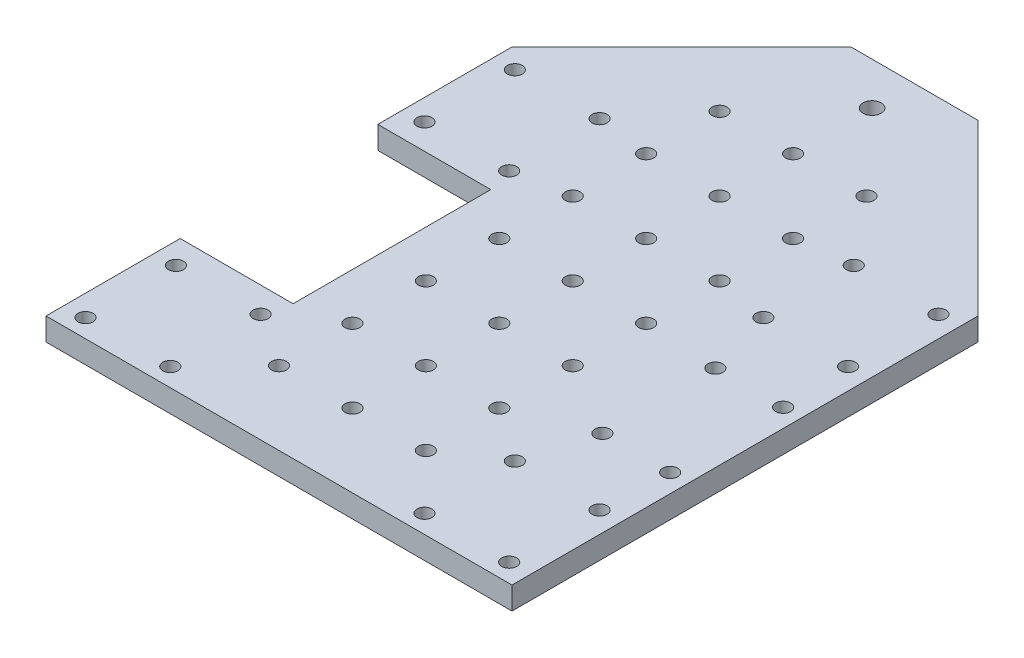
from build123d import *

# Parameters (mm, degrees)
SKETCH1_W                = 165
SKETCH1_H                = 225
BOSS_EXTRUDE1_DEPTH      = 8
SKETCH2_W                = 40
SKETCH2_H                = 70
CUT_EXTRUDE1_DEPTH       = 280.130793715
CHAMFER1_SIZE            = 60
M6_CLEARANCE_HOLE1_D     = 6.4
M6_CLEARANCE_HOLE1_DEPTH = 8
M6_CLEARANCE_HOLE1_TIP   = 1.922753981
M5_CLEARANCE_HOLE1_D     = 5.3
M5_CLEARANCE_HOLE1_DEPTH = 8
M5_CLEARANCE_HOLE1_TIP   = 1.59228064
M5_CLEARANCE_HOLE2_D     = 5.3
M5_CLEARANCE_HOLE2_DEPTH = 8
M5_CLEARANCE_HOLE2_TIP   = 1.59228064


with BuildPart() as part:
    # Sketch1 → Boss-Extrude1 (new body)
    with BuildSketch(Plane(origin=(0, 0, 0), x_dir=(1, 0, 0), z_dir=(0, 1, 0))):
        with Locations((82.5, 112.5)):
            Rectangle(SKETCH1_W, SKETCH1_H)
    extrude(amount=BOSS_EXTRUDE1_DEPTH)

    # Sketch2 → Cut-Extrude1 (cut, through all)
    with BuildSketch(Plane.XZ):
        with Locations((20, -82.5)):
            Rectangle(SKETCH2_W, SKETCH2_H)
    extrude(amount=-CUT_EXTRUDE1_DEPTH, mode=Mode.SUBTRACT)

    # Chamfer1
    chamfer1_edges = [part.edges().sort_by_distance(p)[0] for p in [
        (0, 4, -225),
        (165, 4, -225),
    ]]
    chamfer(chamfer1_edges, length=CHAMFER1_SIZE)

    # M6 Clearance Hole1
    with Locations(Plane(origin=(0, 8, 0), x_dir=(1, 0, 0), z_dir=(0, 1, 0))):
        with Locations((82.5, 210)):
            Hole(M6_CLEARANCE_HOLE1_D / 2, depth=M6_CLEARANCE_HOLE1_DEPTH)
            with Locations((0, 0, -(M6_CLEARANCE_HOLE1_DEPTH + M6_CLEARANCE_HOLE1_TIP / 2))):  # 118° drill point
                Cone(0, M6_CLEARANCE_HOLE1_D / 2, M6_CLEARANCE_HOLE1_TIP, mode=Mode.SUBTRACT)

    # M5 Clearance Hole1
    with Locations(Plane(origin=(0, 8, 0), x_dir=(1, 0, 0), z_dir=(0, 1, 0))):
        with Locations((7.5, 158.5), (37.5, 158.5), (37.5, 126.5), (7.5, 126.5), (158.5, 102.5), (134.5, 102.5), (157.5, 126.5), (127.5, 126.5), (127.5, 158.5), (157.5, 158.5), (157.5, 6.5), (127.5, 6.5), (127.5, 38.5), (157.5, 38.5), (134.5, 62.5), (158.5, 62.5), (7.5, 38.5), (37.5, 38.5), (37.5, 6.5), (7.5, 6.5)):
            Hole(M5_CLEARANCE_HOLE1_D / 2, depth=M5_CLEARANCE_HOLE1_DEPTH)
            with Locations((0, 0, -(M5_CLEARANCE_HOLE1_DEPTH + M5_CLEARANCE_HOLE1_TIP / 2))):  # 118° drill point
                Cone(0, M5_CLEARANCE_HOLE1_D / 2, M5_CLEARANCE_HOLE1_TIP, mode=Mode.SUBTRACT)

    # M5 Clearance Hole2
    with Locations(Plane(origin=(0, 8, 0), x_dir=(1, 0, 0), z_dir=(0, 1, 0))):
        with Locations((56.5, 26), (82.5, 26), (108.5, 26), (82.5, 52), (108.5, 52), (82.5, 78), (108.5, 78), (82.5, 104), (108.5, 104), (82.5, 130), (108.5, 130), (82.5, 156), (108.5, 156), (82.5, 182), (108.5, 182), (56.5, 52), (56.5, 78), (56.5, 104), (56.5, 130), (56.5, 156), (56.5, 182)):
            Hole(M5_CLEARANCE_HOLE2_D / 2, depth=M5_CLEARANCE_HOLE2_DEPTH)
            with Locations((0, 0, -(M5_CLEARANCE_HOLE2_DEPTH + M5_CLEARANCE_HOLE2_TIP / 2))):  # 118° drill point
                Cone(0, M5_CLEARANCE_HOLE2_D / 2, M5_CLEARANCE_HOLE2_TIP, mode=Mode.SUBTRACT)


solid = part.part
